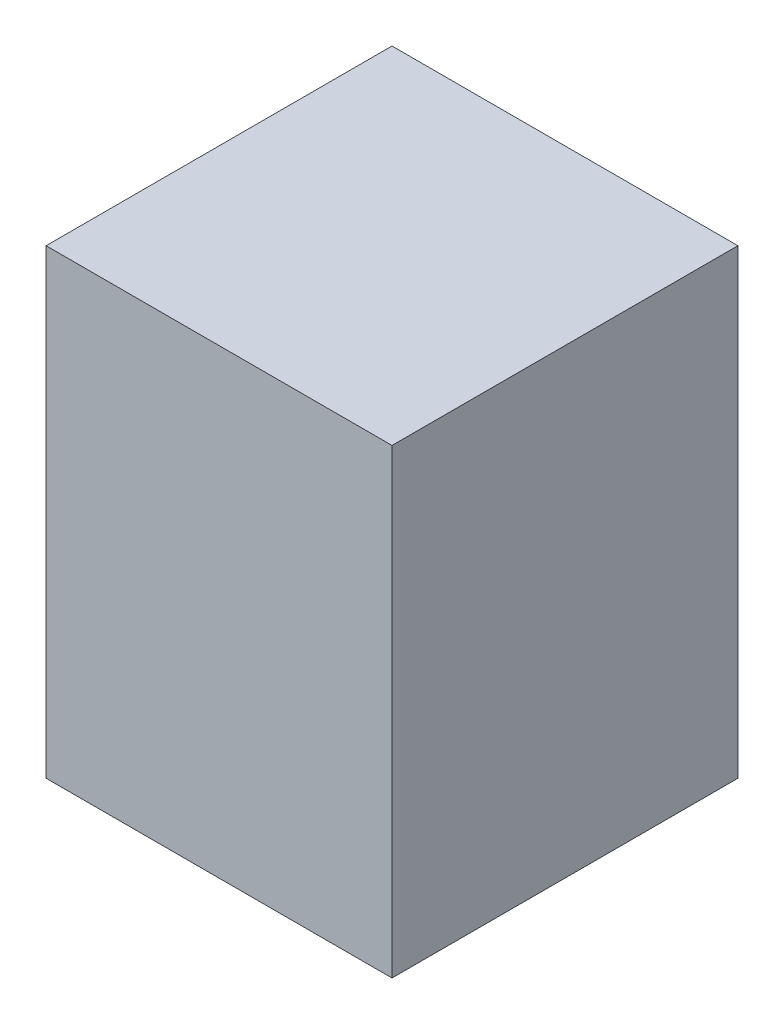
from build123d import *

# Parameters (mm, degrees)
SKETCH2_W           = 30
SKETCH2_H           = 30
BOSS_EXTRUDE1_DEPTH = 40
SKETCH3_R           = 1.5
CUT_EXTRUDE1_DEPTH  = 17


with BuildPart() as part:
    # Sketch2 → Boss-Extrude1 (new body)
    with BuildSketch(Plane(origin=(0, 0, 0), x_dir=(1, 0, 0), z_dir=(0, 1, 0))):
        Rectangle(SKETCH2_W, SKETCH2_H)
    extrude(amount=BOSS_EXTRUDE1_DEPTH)

    # Sketch3 → Cut-Extrude1 (cut)
    with BuildSketch(Plane.XZ):
        with Locations(Location((0, 10.5, 0), (0, 0, 270))):
            Circle(SKETCH3_R)
        with Locations(Location((10.5, 0, 0), (0, 0, 270))):
            Circle(SKETCH3_R)
        with Locations(Location((0, -10.5, 0), (0, 0, 270))):
            Circle(SKETCH3_R)
        with Locations(Location((-10.5, 0, 0), (0, 0, 270))):
            Circle(SKETCH3_R)
    extrude(amount=-CUT_EXTRUDE1_DEPTH, mode=Mode.SUBTRACT)


solid = part.part
